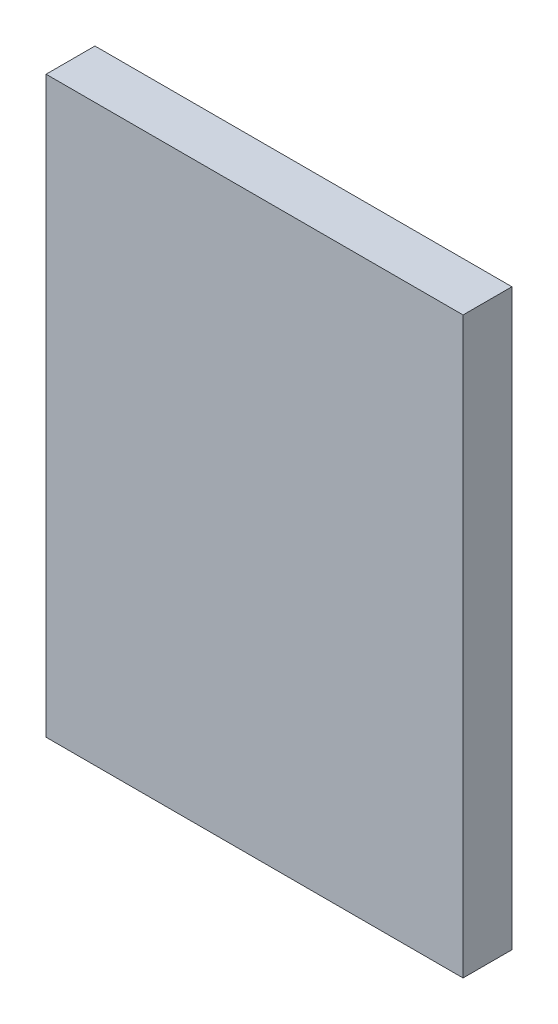
from build123d import *

# Parameters (mm, degrees)
LCD_SK1_W = 35
LCD_SK1_H = 48.2
LCD_DEPTH = 4.1


with BuildPart() as part:
    # LCD_Sk1 → LCD (new body)
    with BuildSketch(Plane.XY.offset(2.1)):
        with Locations((0, -1.7)):
            Rectangle(LCD_SK1_W, LCD_SK1_H)
    extrude(amount=-LCD_DEPTH)


solid = part.part
